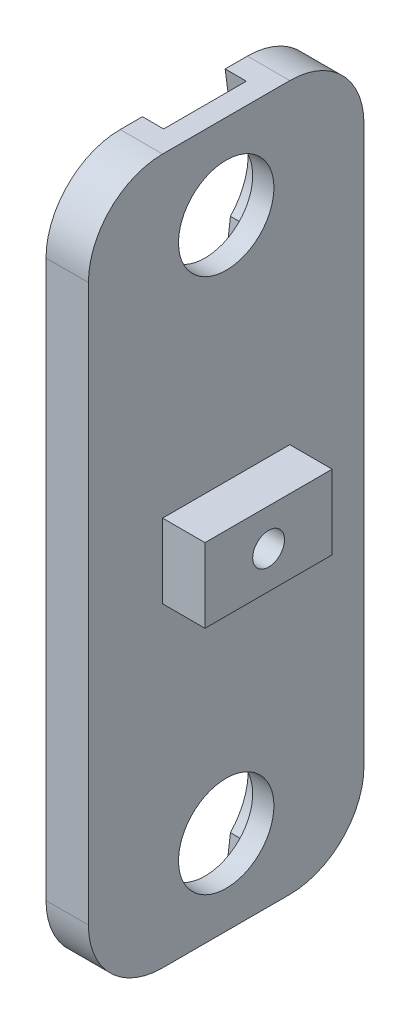
from build123d import *

# Parameters (mm, degrees)
SKETCH_1_W             = 36.75
SKETCH_1_H             = 26
EXTRUDE_1_DEPTH        = 4
CUT_EXTRUDE_1_DEPTH    = 2
FILLET_1_R             = 7
CUT_EXTRUDE_3_DEPTH    = 2
SKETCH_11_W            = 12
SKETCH_11_H            = 7
EXTRUDE_2_DEPTH        = 4
SKETCH_12_R            = 1.5
CUT_EXTRUDE_4_DEPTH    = 8
SKETCH_13_R            = 2.75
CUT_EXTRUDE_5_DEPTH    = 1
FILLET_1_OF_MIRROR_2_R = 7


with BuildPart() as part:
    # Эскиз1 → Бобышка-Вытянуть1 (new body)
    with BuildSketch(Plane(origin=(0, 0, 0), x_dir=(0, -1, 0), z_dir=(-1, 0, 0))):
        with Locations((-0.875, 0)):
            Rectangle(SKETCH_1_W, SKETCH_1_H)
    extrude_1 = extrude(amount=-EXTRUDE_1_DEPTH)

    # Эскиз2 → Вырез-Вытянуть1 (cut)
    with BuildSketch(Plane.ZY):
        with BuildLine():
            Line((3.901238196, -17.5), (4.545454545, -13.652408939))
            ThreePointArc((4.545454545, -13.652408939), (6.222727273, -9.431365141), (4.545454545, -5.210321344))
            Line((4.545454545, -5.210321344), (2.795454545, 8.289678656))
            ThreePointArc((2.795454545, 8.289678656), (0.072727273, 11.012405929), (-2.65, 8.289678656))
            Line((-2.65, 8.289678656), (-4.4, -5.210321344))
            ThreePointArc((-4.4, -5.210321344), (-6.077272727, -9.431365141), (-4.4, -13.652408939))
            Line((-4.4, -13.652408939), (-3.901238196, -17.5))
            Line((-3.901238196, -17.5), (3.901238196, -17.5))
        make_face()
    cut_extrude_1 = extrude(amount=-CUT_EXTRUDE_1_DEPTH, mode=Mode.SUBTRACT)

    # Скругление1
    fillet_1_edges = [part.edges().sort_by_distance(p)[0] for p in [
        (2, -17.5, 13),
        (2, -17.5, -13),
    ]]
    fillet(fillet_1_edges, radius=FILLET_1_R)

    # Эскиз9 → Вырез-Вытянуть3 (cut)
    with BuildSketch(Plane.ZY.offset(-2)):
        with BuildLine():
            ThreePointArc((4.5, -9.5), (-3.181980515, -6.318019485), (0, -14))
            Line((0, -14), (0, -9.5))
            Line((0, -9.5), (4.5, -9.5))
        make_face()
        with BuildLine():
            Line((0, -9.5), (0, -14))
            ThreePointArc((0, -14), (3.181980515, -12.681980515), (4.5, -9.5))
            Line((4.5, -9.5), (0, -9.5))
        make_face()
    cut_extrude_3 = extrude(amount=-CUT_EXTRUDE_3_DEPTH, mode=Mode.SUBTRACT)

    # Эскиз11 → Бобышка-Вытянуть2 (add)
    with BuildSketch(Plane(origin=(4, 0, 0), x_dir=(0, 0, -1), z_dir=(1, 0, 0))):
        with Locations((0, 15.75)):
            Rectangle(SKETCH_11_W, SKETCH_11_H)
    extrude_2 = extrude(amount=EXTRUDE_2_DEPTH)

    # Эскиз12 → Вырез-Вытянуть4 (cut)
    with BuildSketch(Plane.ZY):
        with Locations((0, 15.75)):
            Circle(SKETCH_12_R)
    cut_extrude_4 = extrude(amount=-CUT_EXTRUDE_4_DEPTH, mode=Mode.SUBTRACT)

    # Эскиз13 → Вырез-Вытянуть5 (cut)
    with BuildSketch(Plane.ZY):
        with Locations((0, 15.75)):
            Circle(SKETCH_13_R)
    cut_extrude_5 = extrude(amount=-CUT_EXTRUDE_5_DEPTH, mode=Mode.SUBTRACT)

    # Зеркальное отражение2: Бобышка-Вытянуть1, Вырез-Вытянуть1, Вырез-Вытянуть3, Бобышка-Вытянуть2, Вырез-Вытянуть4, Вырез-Вытянуть5 across plane
    add(extrude_1.mirror(Plane.ZX.offset(15.75)))
    add(cut_extrude_1.mirror(Plane.ZX.offset(15.75)), mode=Mode.SUBTRACT)
    add(cut_extrude_3.mirror(Plane.ZX.offset(15.75)), mode=Mode.SUBTRACT)
    add(extrude_2.mirror(Plane.ZX.offset(15.75)))
    add(cut_extrude_4.mirror(Plane.ZX.offset(15.75)), mode=Mode.SUBTRACT)
    add(cut_extrude_5.mirror(Plane.ZX.offset(15.75)), mode=Mode.SUBTRACT)

    # Скругление1 of Зеркальное отражение2
    fillet_1_of_mirror_2_edges = [part.edges().sort_by_distance(p)[0] for p in [
        (2, 49, 13),
        (2, 49, -13),
    ]]
    fillet(fillet_1_of_mirror_2_edges, radius=FILLET_1_OF_MIRROR_2_R)


solid = part.part
